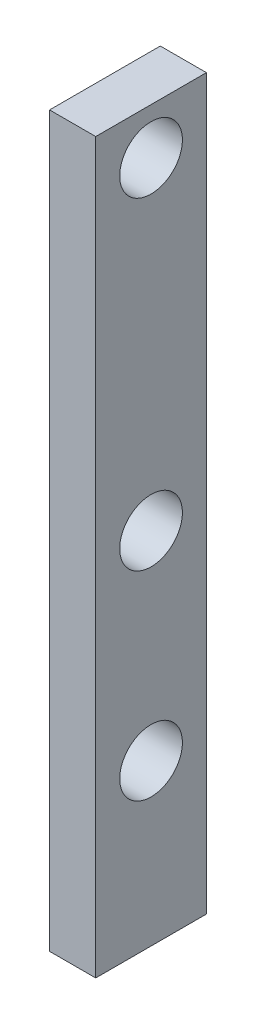
from build123d import *

# Parameters (mm, degrees)
SKETCH2_W           = 6
SKETCH2_H           = 39.5
SKETCH2_R           = 1.7
BOSS_EXTRUDE1_DEPTH = 2.5


with BuildPart() as part:
    # Sketch2 → Boss-Extrude1 (new body)
    with BuildSketch(Plane(origin=(0, 0, 0), x_dir=(0, 0, -1), z_dir=(1, 0, 0))):
        with Locations((3, 19.75)):
            Rectangle(SKETCH2_W, SKETCH2_H)
        with Locations((3, 8.7)):
            Circle(SKETCH2_R, mode=Mode.SUBTRACT)
        with Locations((3, 19.5)):
            Circle(SKETCH2_R, mode=Mode.SUBTRACT)
        with Locations((3, 37)):
            Circle(SKETCH2_R, mode=Mode.SUBTRACT)
    extrude(amount=BOSS_EXTRUDE1_DEPTH)


solid = part.part
